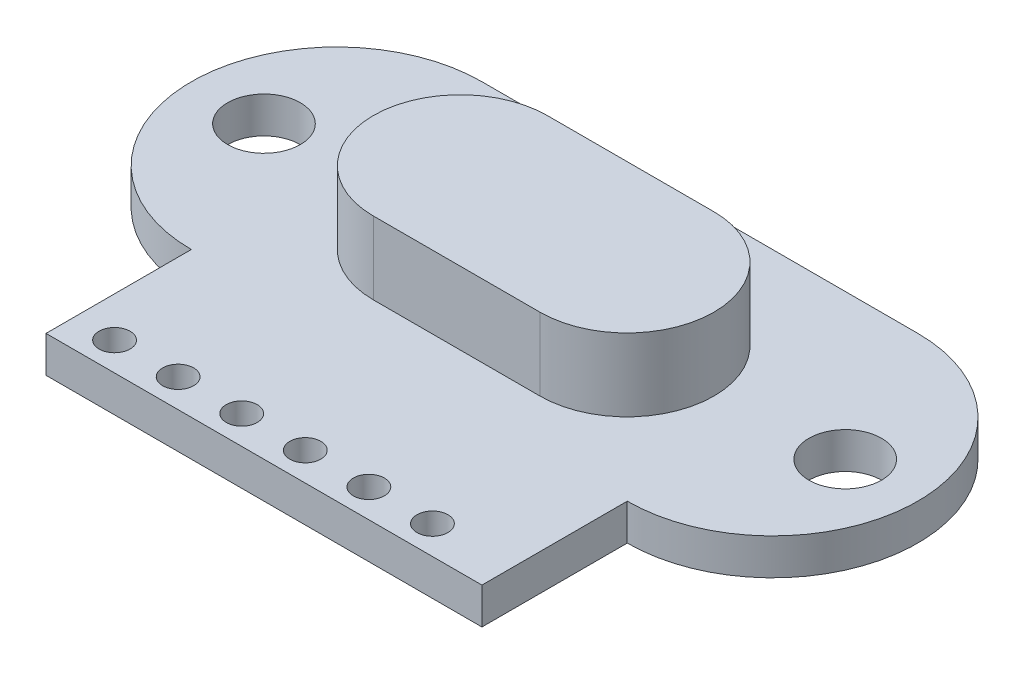
from build123d import *

# Parameters (mm, degrees)
BOSS_EXTRUDE1_DEPTH = 1
SKETCH2_W           = 12
SKETCH2_H           = 4
BOSS_EXTRUDE2_DEPTH = 1
SKETCH3_R           = 1
SKETCH3_R_2         = 0.426779722
CUT_EXTRUDE1_DEPTH  = 16.652475842
BOSS_EXTRUDE3_DEPTH = 2
SKETCH5_W           = 8.547335384
SKETCH5_H           = 5.323692461
BOSS_EXTRUDE4_DEPTH = 1


with BuildPart() as part:
    # Sketch1 → Boss-Extrude1 (new body)
    with BuildSketch(Plane(origin=(0, 0, 0), x_dir=(1, 0, 0), z_dir=(0, 1, 0))):
        with BuildLine():
            Line((-6, 12), (6, 12))
            ThreePointArc((6, 12), (10, 8), (6, 4))
            Line((6, 4), (-6, 4))
            ThreePointArc((-6, 4), (-10, 8), (-6, 12))
        make_face()
    extrude(amount=BOSS_EXTRUDE1_DEPTH)

    # Sketch2 → Boss-Extrude2 (add)
    with BuildSketch(Plane.XZ):
        with Locations((0, -2)):
            Rectangle(SKETCH2_W, SKETCH2_H)
    extrude(amount=-BOSS_EXTRUDE2_DEPTH)

    # Sketch3 → Cut-Extrude1 (cut, through all)
    with BuildSketch(Plane(origin=(0, 1, 0), x_dir=(1, 0, 0), z_dir=(0, 1, 0))):
        with Locations(Location((8, 8, 0), (0, 0, 270))):
            Circle(SKETCH3_R)
        with Locations(Location((-8, 8, 0), (0, 0, 270))):
            Circle(SKETCH3_R)
        with Locations(Location((-4.895656887, 0.783316432, 0), (0, 0, 270))):
            Circle(SKETCH3_R_2)
        with Locations(Location((-3.145656887, 0.783316432, 0), (0, 0, 270))):
            Circle(SKETCH3_R_2)
        with Locations(Location((-1.395656887, 0.783316432, 0), (0, 0, 270))):
            Circle(SKETCH3_R_2)
        with Locations(Location((0.354343113, 0.783316432, 0), (0, 0, 270))):
            Circle(SKETCH3_R_2)
        with Locations(Location((2.104343113, 0.783316432, 0), (0, 0, 270))):
            Circle(SKETCH3_R_2)
        with Locations(Location((3.854343113, 0.783316432, 0), (0, 0, 270))):
            Circle(SKETCH3_R_2)
    extrude(amount=-CUT_EXTRUDE1_DEPTH, mode=Mode.SUBTRACT)

    # Sketch4 → Boss-Extrude3 (add)
    with BuildSketch(Plane(origin=(0, 1, 0), x_dir=(1, 0, 0), z_dir=(0, 1, 0))):
        with BuildLine():
            Line((-2.294003159, 10.093090184), (2.294003159, 10.093090184))
            ThreePointArc((2.294003159, 10.093090184), (4.688327155, 7.698766187), (2.294003159, 5.304442191))
            Line((2.294003159, 5.304442191), (-2.294003159, 5.304442191))
            ThreePointArc((-2.294003159, 5.304442191), (-4.688327155, 7.698766187), (-2.294003159, 10.093090184))
        make_face()
    extrude(amount=BOSS_EXTRUDE3_DEPTH)

    # Sketch5 → Boss-Extrude4 (add)
    with BuildSketch(Plane.XZ):
        with Locations((-0.127073061, -6.949703932)):
            Rectangle(SKETCH5_W, SKETCH5_H)
    extrude(amount=BOSS_EXTRUDE4_DEPTH)


solid = part.part
